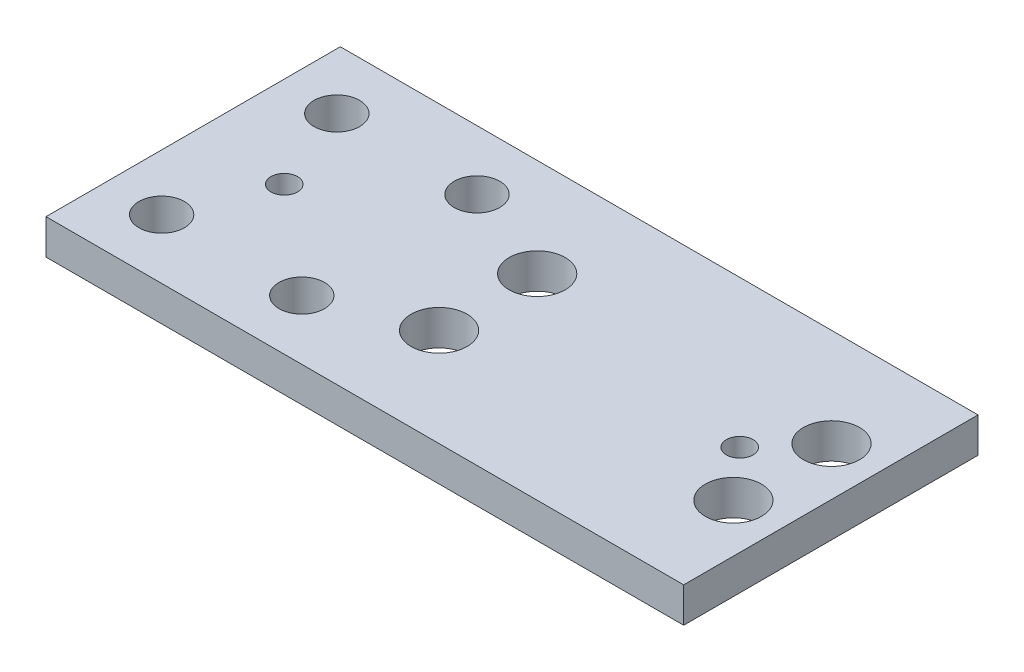
from build123d import *

# Parameters (mm, degrees)
SKETCH_1_W          = 91
SKETCH_1_H          = 42
EXTRUDE_1_DEPTH     = 5
SKETCH_2_R          = 1.75
SKETCH_2_R_2        = 2.25
SKETCH_2_R_3        = 1.9
CUT_EXTRUDE_1_DEPTH = 5
SKETCH_3_R          = 4
SKETCH_3_R_2        = 3.25
CUT_EXTRUDE_2_DEPTH = 5


with BuildPart() as part:
    # 스케치1 → 보스-돌출1 (new body)
    with BuildSketch(Plane(origin=(0, 0, 0), x_dir=(1, 0, 0), z_dir=(0, 1, 0))):
        with Locations((45.5, 21)):
            Rectangle(SKETCH_1_W, SKETCH_1_H)
    extrude(amount=EXTRUDE_1_DEPTH)

    # 스케치2 → 컷-돌출1 (cut)
    with BuildSketch(Plane(origin=(0, 5, 0), x_dir=(1, 0, 0), z_dir=(0, 1, 0))):
        with Locations(Location((28, 33.5, 0), (0, 0, 270))):
            Circle(SKETCH_2_R)
        with Locations(Location((28, 8.5, 0), (0, 0, 270))):
            Circle(SKETCH_2_R)
        with Locations(Location((8, 8.5, 0), (0, 0, 270))):
            Circle(SKETCH_2_R)
        with Locations(Location((8, 33.5, 0), (0, 0, 270))):
            Circle(SKETCH_2_R)
        with Locations(Location((42.094873015, 28, 0), (0, 0, 270))):
            Circle(SKETCH_2_R_2)
        with Locations(Location((42.094873015, 14, 0), (0, 0, 270))):
            Circle(SKETCH_2_R_2)
        with Locations(Location((84.094873015, 14, 0), (0, 0, 270))):
            Circle(SKETCH_2_R_2)
        with Locations(Location((84.094873015, 28, 0), (0, 0, 270))):
            Circle(SKETCH_2_R_2)
        with Locations(Location((78, 21, 0), (0, 0, 270))):
            Circle(SKETCH_2_R_3)
        with Locations(Location((13, 21, 0), (0, 0, 270))):
            Circle(SKETCH_2_R_3)
    extrude(amount=-CUT_EXTRUDE_1_DEPTH, mode=Mode.SUBTRACT)

    # 스케치3 → 컷-돌출2 (cut)
    with BuildSketch(Plane(origin=(0, 5, 0), x_dir=(1, 0, 0), z_dir=(0, 1, 0))):
        with Locations(Location((84.094873015, 28, 0), (0, 0, 270))):
            Circle(SKETCH_3_R)
        with Locations(Location((84.094873015, 14, 0), (0, 0, 270))):
            Circle(SKETCH_3_R)
        with Locations(Location((42.094873015, 14, 0), (0, 0, 270))):
            Circle(SKETCH_3_R)
        with Locations(Location((42.094873015, 28, 0), (0, 0, 270))):
            Circle(SKETCH_3_R)
        with Locations(Location((28, 33.5, 0), (0, 0, 270))):
            Circle(SKETCH_3_R_2)
        with Locations(Location((28, 8.5, 0), (0, 0, 270))):
            Circle(SKETCH_3_R_2)
        with Locations(Location((8, 8.5, 0), (0, 0, 270))):
            Circle(SKETCH_3_R_2)
        with Locations(Location((8, 33.5, 0), (0, 0, 270))):
            Circle(SKETCH_3_R_2)
    extrude(amount=-CUT_EXTRUDE_2_DEPTH, mode=Mode.SUBTRACT)


solid = part.part
